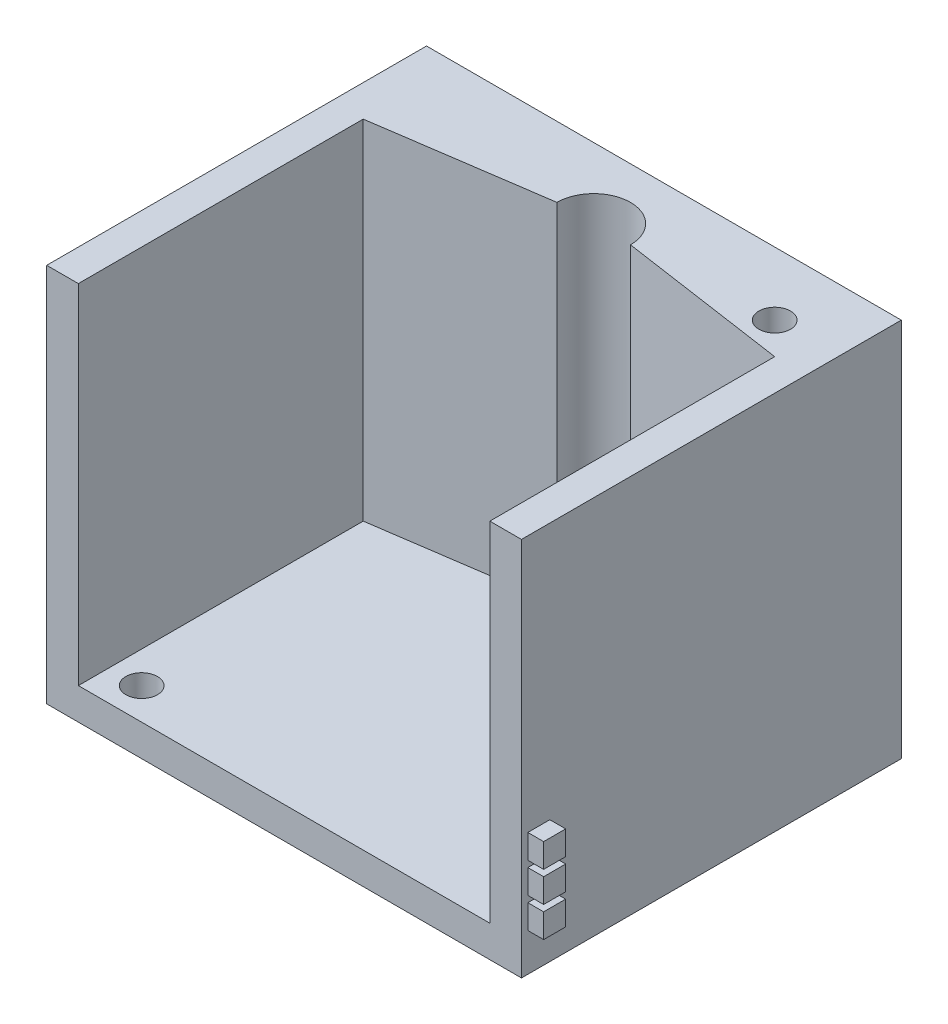
from build123d import *

# Parameters (mm, degrees)
SKETCH1_W                = 150
SKETCH1_H                = 120
BASEBOX_DEPTH            = 120
SKETCH2_W                = 130
SKETCH2_H                = 110
INTERIORCUT_DEPTH        = 110
POSITIONCALIBRATOR_DEPTH = 110
SKETCH6_W                = 6.959896851
SKETCH6_H                = 7.60749883
LASERRECEIVER_DEPTH      = 5
THREADEDROD_DEPTH        = 225.77766793
THREADEDROD_DEPTH_BACK   = 225.77766793
SKETCH3_R                = 5


with BuildPart() as part:
    # Sketch1 → BaseBox (new body)
    with BuildSketch(Plane(origin=(0, 0, 0), x_dir=(1, 0, 0), z_dir=(0, 1, 0))):
        with Locations((75, 60)):
            Rectangle(SKETCH1_W, SKETCH1_H)
    extrude(amount=BASEBOX_DEPTH)

    # Sketch2 → InteriorCut (cut)
    with BuildSketch(Plane(origin=(0, 120, 0), x_dir=(1, 0, 0), z_dir=(0, 1, 0))):
        with Locations((75, 55)):
            Rectangle(SKETCH2_W, SKETCH2_H)
    extrude(amount=-INTERIORCUT_DEPTH, mode=Mode.SUBTRACT)

    # Sketch5 → PositionCalibrator (add)
    with BuildSketch(Plane(origin=(0, 10, 0), x_dir=(1, 0, 0), z_dir=(0, 1, 0))):
        with BuildLine():
            Line((63.383989491, 97.819381253), (10, 90))
            Line((10, 90), (10, 110))
            Line((10, 110), (140, 110))
            Line((140, 110), (140, 90))
            Line((140, 90), (86.616010509, 97.819381253))
            ThreePointArc((86.616010509, 97.819381253), (75, 109.435391763), (63.383989491, 97.819381253))
        make_face()
    extrude(amount=POSITIONCALIBRATOR_DEPTH)

    # Sketch6 → LaserReceiver (add)
    with BuildSketch(Plane(origin=(150, 0, 0), x_dir=(0, 0, -1), z_dir=(1, 0, 0))):
        with Locations((5.479948425, 35.018747075)):
            Rectangle(SKETCH6_W, SKETCH6_H)
        with Locations((5.479948425, 15.803749415)):
            Rectangle(SKETCH6_W, SKETCH6_H)
        with Locations((5.479948425, 25.411248245)):
            Rectangle(SKETCH6_W, SKETCH6_H)
    extrude(amount=LASERRECEIVER_DEPTH)

    # Sketch3 → ThreadedRod (cut, two sides: drawn at the far end of the back side and taken through both)
    with BuildSketch(Plane(origin=(0, 10, 0), x_dir=(1, 0, 0), z_dir=(0, 1, 0)).offset(-THREADEDROD_DEPTH_BACK)):
        with Locations(Location((20, 10, 0), (0, 0, 270))):
            Circle(SKETCH3_R)
        with Locations(Location((130, 100, 0), (0, 0, 270))):
            Circle(SKETCH3_R)
    extrude(amount=THREADEDROD_DEPTH + THREADEDROD_DEPTH_BACK, mode=Mode.SUBTRACT)


solid = part.part
